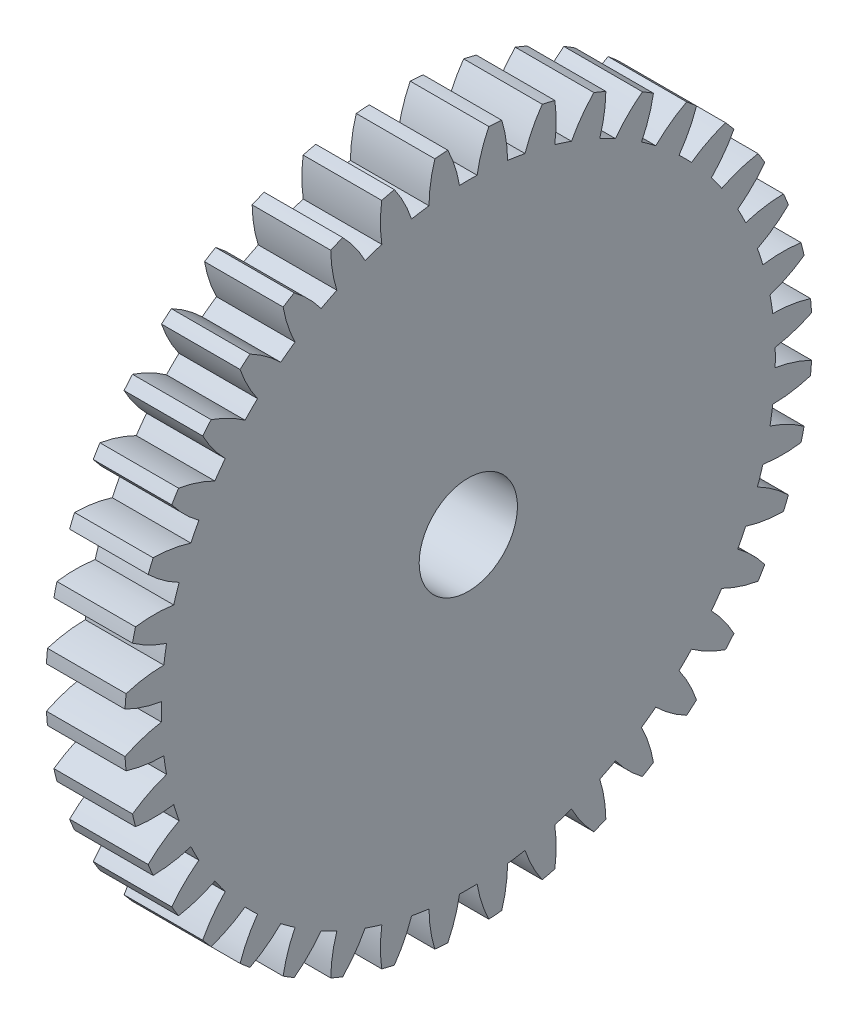
from build123d import *

# Parameters (mm, degrees)
BASPROSKE_W     = 7.62
BASPROSKE_H     = 33.3375
TOOTHCUT_DEPTH  = 48.758163831
TEETHCUTS_COUNT = 40
TEETHCUTS_ANGLE = 351
BORSKE_R        = 4.7625
BORE_DEPTH      = 50.8000508


with BuildPart() as part:
    # BasProSke → Base-Revolve (revolve)
    with BuildSketch(Plane(origin=(0, 0, 0), x_dir=(1, 0, 0), z_dir=(0, 1, 0)), mode=Mode.PRIVATE) as base_revolve_sk:
        with Locations((3.81, 16.66875)):
            Rectangle(BASPROSKE_W, BASPROSKE_H)
    revolve(base_revolve_sk.sketch.rotate(Axis((-10, 0, 0), (1, 0, 0)), 180), axis=Axis((-10, 0, 0), (1, 0, 0)))

    # TooCutSke → ToothCut (cut, through all)
    with BuildSketch(Plane(origin=(0, 0, 0), x_dir=(0, 0, -1), z_dir=(1, 0, 0))):
        with BuildLine():
            ThreePointArc((0.855128208, 29.752068572), (0, 29.764355), (-0.855128208, 29.752068572))
            ThreePointArc((-0.855128208, 29.752068572), (-1.296532984, 31.569755125), (-2.000140367, 33.302890789))
            ThreePointArc((-2.000140367, 33.302890789), (0, 33.3629), (2.000140367, 33.302890789))
            ThreePointArc((2.000140367, 33.302890789), (1.296532984, 31.569755125), (0.855128208, 29.752068572))
        make_face()
    toothcut = extrude(amount=TOOTHCUT_DEPTH, mode=Mode.SUBTRACT)

    # TeethCuts: ToothCut ×40 about axis
    teethcuts_axis = Axis((-10, 0, 0), (1, 0, 0))
    for i in range(1, TEETHCUTS_COUNT):
        add(toothcut.rotate(teethcuts_axis, i * TEETHCUTS_ANGLE / (TEETHCUTS_COUNT - 1)), mode=Mode.SUBTRACT)

    # BorSke → Bore (cut, symmetric)
    with BuildSketch(Plane(origin=(0, 0, 0), x_dir=(0, 0, -1), z_dir=(1, 0, 0))):
        with Locations(Location((0, 0, 0), (0, 0, 180))):
            Circle(BORSKE_R)
    extrude(amount=BORE_DEPTH, both=True, mode=Mode.SUBTRACT)


solid = part.part
